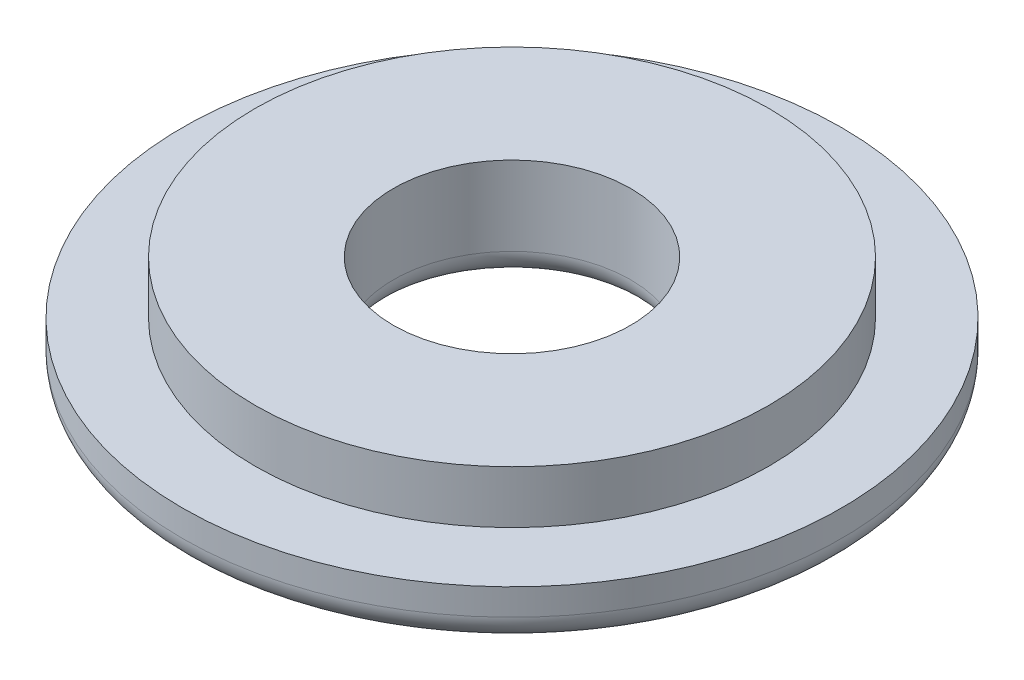
from build123d import *

# Parameters (mm, degrees)
SKETCH1_R           = 12.5
BOSS_EXTRUDE1_DEPTH = 2
SKETCH2_R           = 9.75
BOSS_EXTRUDE2_DEPTH = 2
SKETCH3_R           = 4.5
CUT_EXTRUDE1_DEPTH  = 19.12456896
FILLET1_R           = 1


with BuildPart() as part:
    # Sketch1 → Boss-Extrude1 (new body)
    with BuildSketch(Plane(origin=(0, 0, 0), x_dir=(1, 0, 0), z_dir=(0, 1, 0))):
        with Locations(Location((0, 0, 0), (0, 0, 270))):
            Circle(SKETCH1_R)
    extrude(amount=BOSS_EXTRUDE1_DEPTH)

    # Sketch2 → Boss-Extrude2 (add)
    with BuildSketch(Plane(origin=(0, 2, 0), x_dir=(1, 0, 0), z_dir=(0, 1, 0))):
        with Locations(Location((0, 0, 0), (0, 0, 270))):
            Circle(SKETCH2_R)
    extrude(amount=BOSS_EXTRUDE2_DEPTH)

    # Sketch3 → Cut-Extrude1 (cut, through all)
    with BuildSketch(Plane(origin=(0, 4, 0), x_dir=(1, 0, 0), z_dir=(0, 1, 0))):
        with Locations(Location((0, 0, 0), (0, 0, 270))):
            Circle(SKETCH3_R)
    extrude(amount=-CUT_EXTRUDE1_DEPTH, mode=Mode.SUBTRACT)

    # Fillet1
    fillet1_edges = [part.edges().sort_by_distance(p)[0] for p in [
        (0, 0, -4.5),
        (0, 0, -12.5),
    ]]
    fillet(fillet1_edges, radius=FILLET1_R)


solid = part.part
